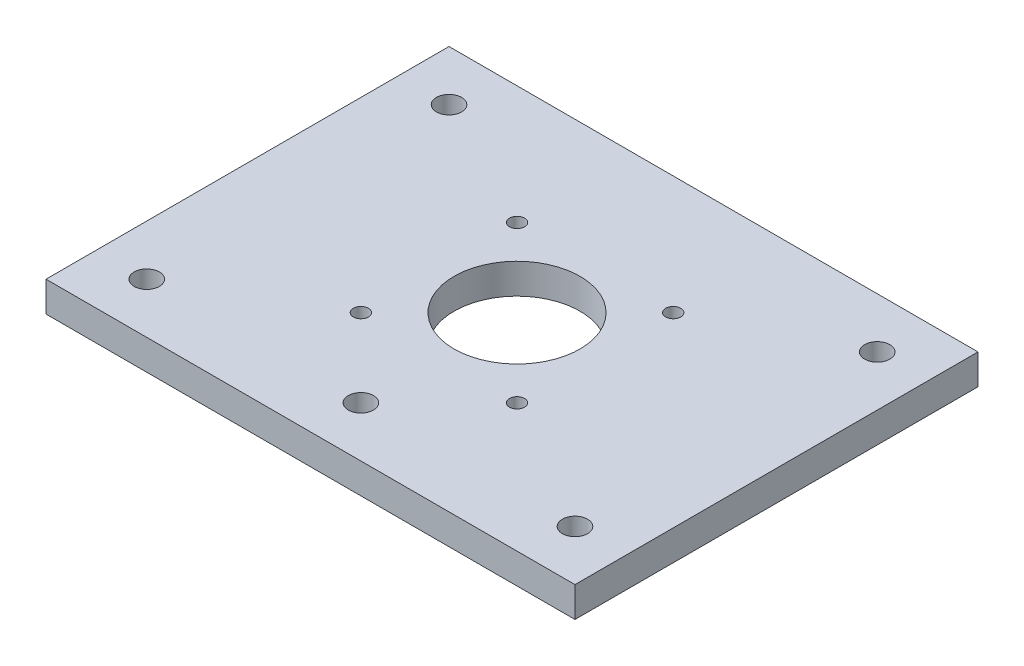
from build123d import *

# Parameters (mm, degrees)
BOSS_EXTRUDE1_DEPTH = 6
SKETCH2_R           = 2.5
SKETCH2_R_2         = 12.5
SKETCH2_R_3         = 1.5
CUT_EXTRUDE1_DEPTH  = 96.876222287


with BuildPart() as part:
    # Sketch1 → Boss-Extrude1 (new body)
    with BuildSketch(Plane(origin=(0, 0, 0), x_dir=(1, 0, 0), z_dir=(0, 1, 0))):
        Polygon((0, 0), (-52.5, 0), (-52.5, 80), (52.5, 80), (52.5, 0), align=None)
    extrude(amount=BOSS_EXTRUDE1_DEPTH)

    # Sketch2 → Cut-Extrude1 (cut, through all)
    with BuildSketch(Plane(origin=(0, 6, 0), x_dir=(1, 0, 0), z_dir=(0, 1, 0))):
        with Locations(Location((-42.5, 70, 0), (0, 0, 270))):
            Circle(SKETCH2_R)
        with Locations(Location((42.5, 70, 0), (0, 0, 270))):
            Circle(SKETCH2_R)
        with Locations(Location((42.5, 10, 0), (0, 0, 270))):
            Circle(SKETCH2_R)
        with Locations(Location((0, 10, 0), (0, 0, 270))):
            Circle(SKETCH2_R)
        with Locations(Location((-42.5, 10, 0), (0, 0, 270))):
            Circle(SKETCH2_R)
        with Locations(Location((0, 41, 0), (0, 0, 270))):
            Circle(SKETCH2_R_2)
        with Locations(Location((-15.5, 56.5, 0), (0, 0, 270))):
            Circle(SKETCH2_R_3)
        with Locations(Location((15.5, 56.5, 0), (0, 0, 270))):
            Circle(SKETCH2_R_3)
        with Locations(Location((-15.5, 25.5, 0), (0, 0, 270))):
            Circle(SKETCH2_R_3)
        with Locations(Location((15.5, 25.5, 0), (0, 0, 270))):
            Circle(SKETCH2_R_3)
    extrude(amount=-CUT_EXTRUDE1_DEPTH, mode=Mode.SUBTRACT)


solid = part.part
